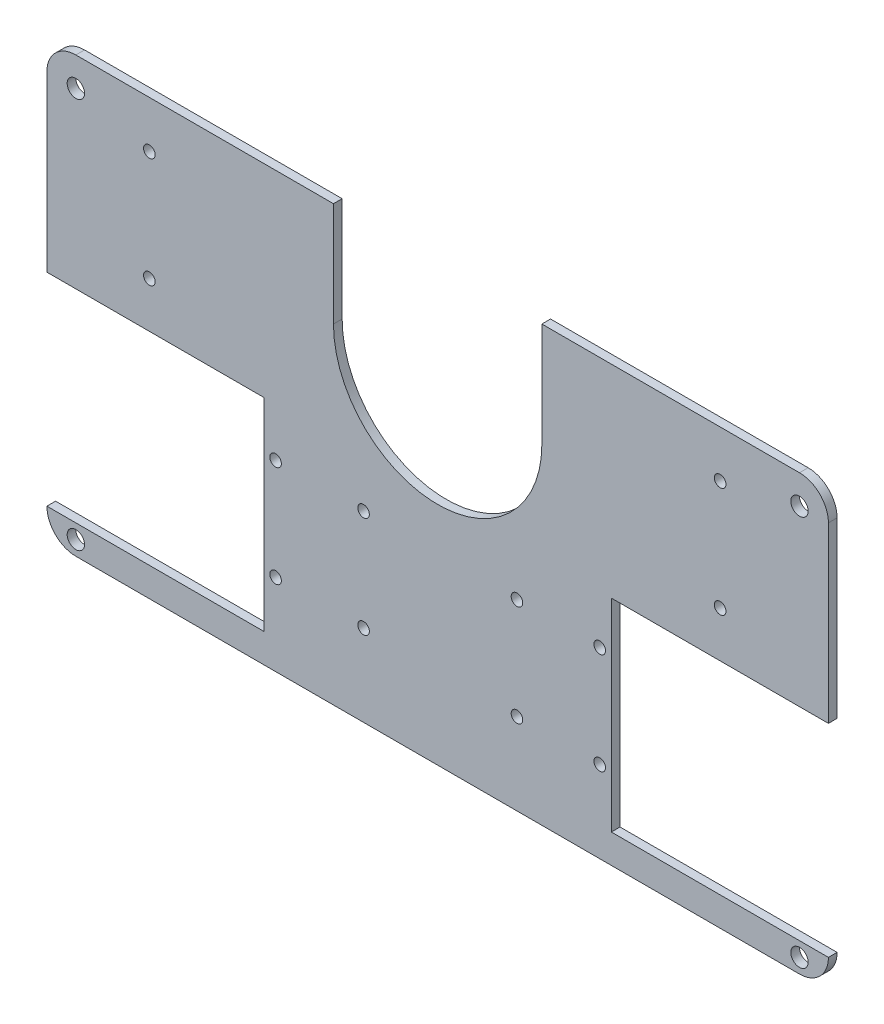
from build123d import *

# Parameters (mm, degrees)
ESQUISSE1_R             = 2
BOSS_EXTRU_1_DEPTH      = 3
ESQUISSE2_W             = 75
ESQUISSE2_H             = 70
ENL_V_MAT_EXTRU_1_DEPTH = 3
ESQUISSE3_R             = 3
ENL_V_MAT_EXTRU_2_DEPTH = 10


with BuildPart() as part:
    # Esquisse1 → Boss.-Extru.1 (new body)
    with BuildSketch(Plane.XY):
        with BuildLine():
            Line((10, 0), (99, 0))
            Line((99, 0), (99, -36))
            ThreePointArc((99, -36), (135, -72), (171, -36))
            Line((171, -36), (171, 0))
            Line((171, 0), (260, 0))
            ThreePointArc((260, 0), (267.071067812, -2.928932188), (270, -10))
            Line((270, -10), (270, -140))
            ThreePointArc((270, -140), (267.071067812, -147.071067812), (260, -150))
            Line((260, -150), (10, -150))
            ThreePointArc((10, -150), (2.928932188, -147.071067812), (0, -140))
            Line((0, -140), (0, -10))
            ThreePointArc((0, -10), (2.928932188, -2.928932188), (10, 0))
        make_face()
        with Locations((109.4, -121.789429788)):
            Circle(ESQUISSE1_R, mode=Mode.SUBTRACT)
        with Locations((109.4, -86.789429788)):
            Circle(ESQUISSE1_R, mode=Mode.SUBTRACT)
        with Locations((79, -121.789429788)):
            Circle(ESQUISSE1_R, mode=Mode.SUBTRACT)
        with Locations((79, -86.789429788)):
            Circle(ESQUISSE1_R, mode=Mode.SUBTRACT)
        with Locations((162.4, -121.789429788)):
            Circle(ESQUISSE1_R, mode=Mode.SUBTRACT)
        with Locations((162.4, -86.789429788)):
            Circle(ESQUISSE1_R, mode=Mode.SUBTRACT)
        with Locations((191, -121.789429788)):
            Circle(ESQUISSE1_R, mode=Mode.SUBTRACT)
        with Locations((191, -86.789429788)):
            Circle(ESQUISSE1_R, mode=Mode.SUBTRACT)
        with Locations((35.4, -16.191238784)):
            Circle(ESQUISSE1_R, mode=Mode.SUBTRACT)
        with Locations((35.4, -54.191238784)):
            Circle(ESQUISSE1_R, mode=Mode.SUBTRACT)
        with Locations((232.6, -16.191238784)):
            Circle(ESQUISSE1_R, mode=Mode.SUBTRACT)
        with Locations((232.6, -54.191238784)):
            Circle(ESQUISSE1_R, mode=Mode.SUBTRACT)
    extrude(amount=BOSS_EXTRU_1_DEPTH)

    # Esquisse2 → Enlèv. mat.-Extru.1 (cut)
    with BuildSketch(Plane.XY.offset(3)):
        with Locations((37.5, -105)):
            Rectangle(ESQUISSE2_W, ESQUISSE2_H)
        with Locations((232.5, -105)):
            Rectangle(ESQUISSE2_W, ESQUISSE2_H)
    extrude(amount=-ENL_V_MAT_EXTRU_1_DEPTH, mode=Mode.SUBTRACT)

    # Esquisse3 → Enlèv. mat.-Extru.2 (cut)
    with BuildSketch(Plane.XY.offset(3)):
        with Locations((10, -10)):
            Circle(ESQUISSE3_R)
        with Locations((260, -10)):
            Circle(ESQUISSE3_R)
        with Locations((260, -145)):
            Circle(ESQUISSE3_R)
        with Locations((10, -145)):
            Circle(ESQUISSE3_R)
    extrude(amount=-ENL_V_MAT_EXTRU_2_DEPTH, mode=Mode.SUBTRACT)


solid = part.part
